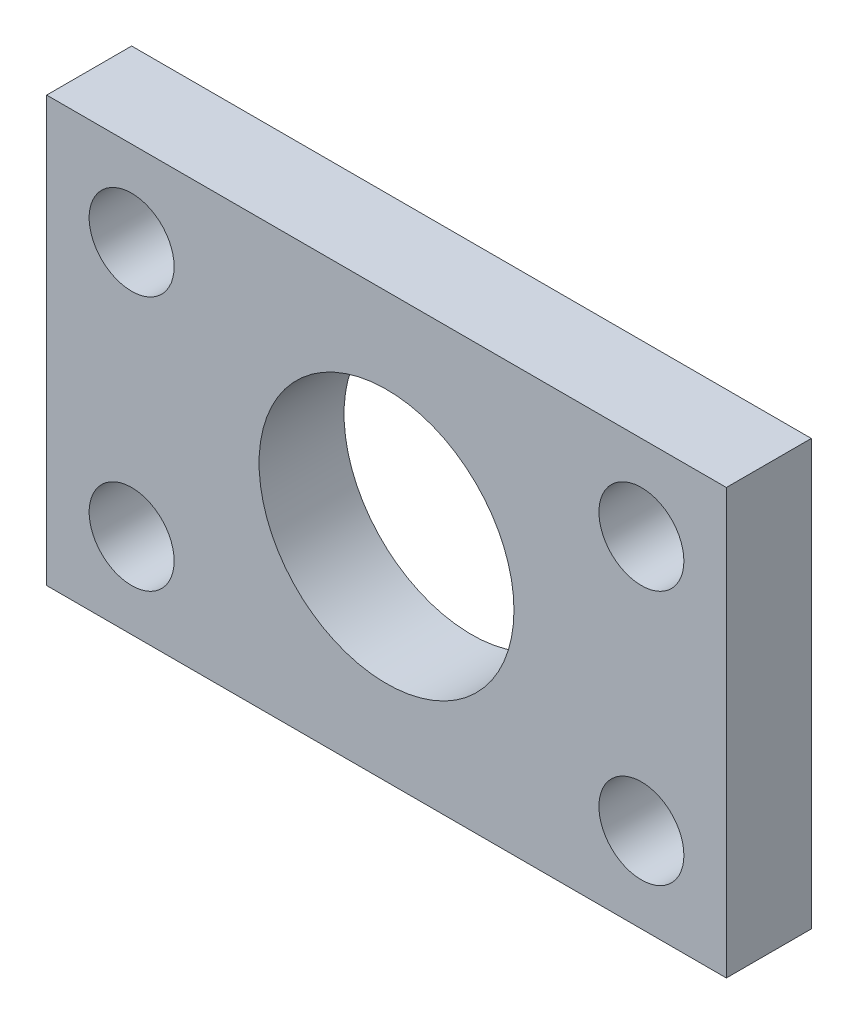
from build123d import *

# Parameters (mm, degrees)
SKETCH2_W           = 203.2
SKETCH2_H           = 127
SKETCH2_R           = 12.7
SKETCH2_R_2         = 38.1
BOSS_EXTRUDE1_DEPTH = 25.4


with BuildPart() as part:
    # Sketch2 → Boss-Extrude1 (new body)
    with BuildSketch(Plane.XY):
        Rectangle(SKETCH2_W, SKETCH2_H)
        with Locations((-76.2, 38.1)):
            Circle(SKETCH2_R, mode=Mode.SUBTRACT)
        with Locations((76.2, -38.1)):
            Circle(SKETCH2_R, mode=Mode.SUBTRACT)
        with Locations((-76.2, -38.1)):
            Circle(SKETCH2_R, mode=Mode.SUBTRACT)
        with Locations((76.2, 38.1)):
            Circle(SKETCH2_R, mode=Mode.SUBTRACT)
        Circle(SKETCH2_R_2, mode=Mode.SUBTRACT)
    extrude(amount=BOSS_EXTRUDE1_DEPTH)


solid = part.part
